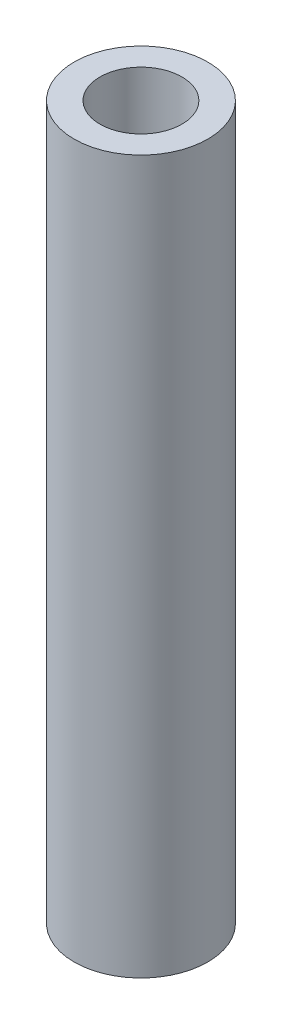
from build123d import *

# Parameters (mm, degrees)
SKETCH1_R           = 2.38125
SKETCH1_R_2         = 1.4605
BOSS_EXTRUDE1_DEPTH = 25.4


with BuildPart() as part:
    # Sketch1 → Boss-Extrude1 (new body)
    with BuildSketch(Plane(origin=(0, 0, 0), x_dir=(1, 0, 0), z_dir=(0, 1, 0))):
        with Locations(Location((0, 0, 0), (0, 0, 270))):
            Circle(SKETCH1_R)
        with Locations(Location((0, 0, 0), (0, 0, 270))):
            Circle(SKETCH1_R_2, mode=Mode.SUBTRACT)
    extrude(amount=BOSS_EXTRUDE1_DEPTH)


solid = part.part
